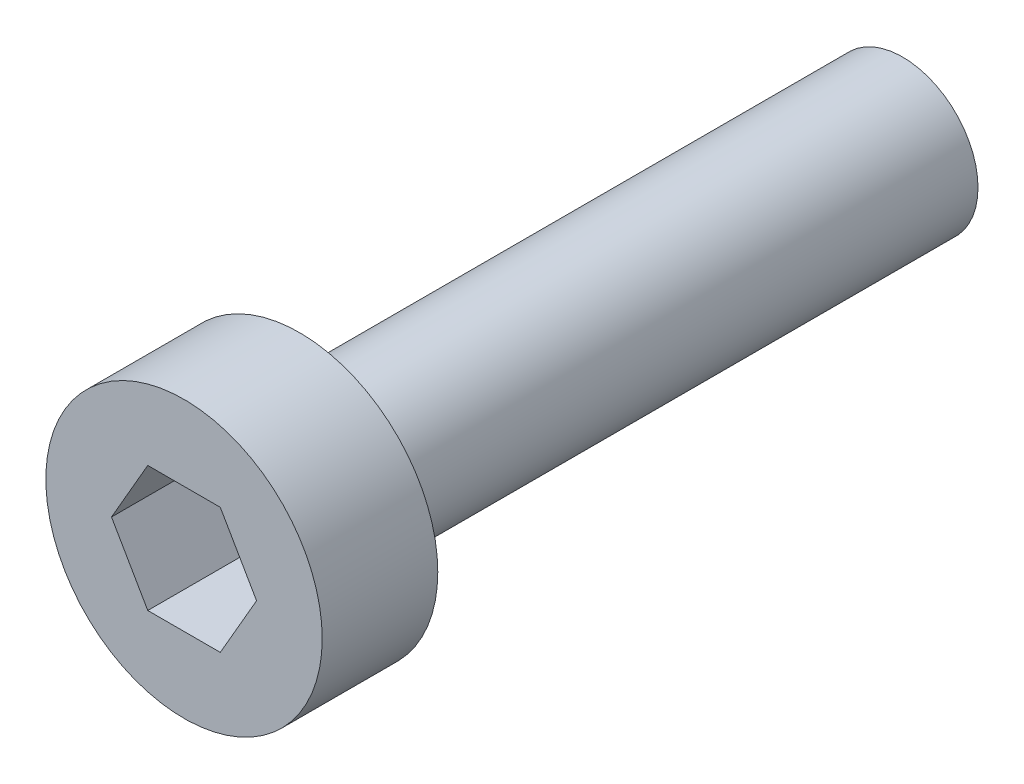
from build123d import *

# Parameters (mm, degrees)
ESQUISSE1_R             = 1.5
BOSS_EXTRU_1_DEPTH      = 12
ESQUISSE2_R             = 2.75
BOSS_EXTRU_2_DEPTH      = 2.3
ENL_V_MAT_EXTRU_1_DEPTH = 2


with BuildPart() as part:
    # Esquisse1 → Boss.-Extru.1 (new body)
    with BuildSketch(Plane.XY):
        Circle(ESQUISSE1_R)
    extrude(amount=BOSS_EXTRU_1_DEPTH)

    # Esquisse2 → Boss.-Extru.2 (add)
    with BuildSketch(Plane.XY.offset(12)):
        Circle(ESQUISSE2_R)
    extrude(amount=BOSS_EXTRU_2_DEPTH)

    # Esquisse3 → Enlèv. mat.-Extru.1 (cut)
    with BuildSketch(Plane.XY.offset(14.3)):
        Polygon((1.443375673, 0), (0.721687836, 1.25), (-0.721687836, 1.25), (-1.443375673, 0), (-0.721687836, -1.25), (0.721687836, -1.25), align=None)
    extrude(amount=-ENL_V_MAT_EXTRU_1_DEPTH, mode=Mode.SUBTRACT)


solid = part.part
